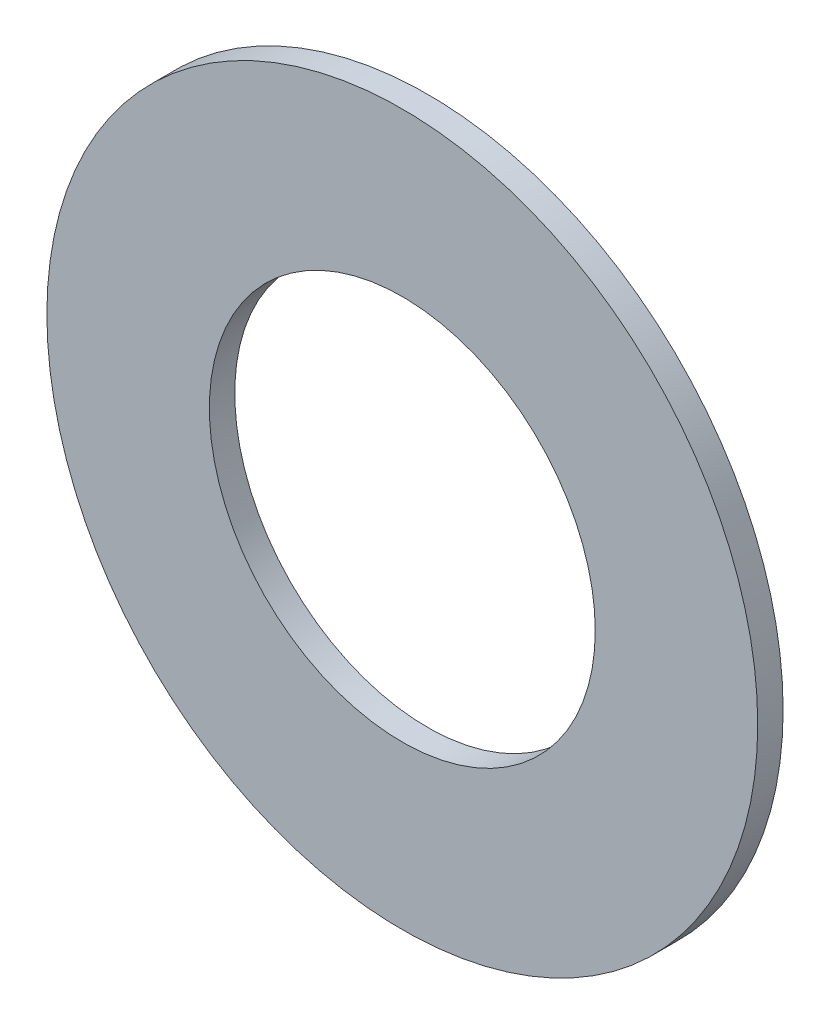
from build123d import *

# Parameters (mm, degrees)
SKETCH_1_R      = 14
SKETCH_1_R_2    = 7.6
EXTRUDE_1_DEPTH = 1


with BuildPart() as part:
    # 草图1 → 凸台-拉伸1 (new body)
    with BuildSketch(Plane.XY):
        Circle(SKETCH_1_R)
        Circle(SKETCH_1_R_2, mode=Mode.SUBTRACT)
    extrude(amount=EXTRUDE_1_DEPTH)


solid = part.part
